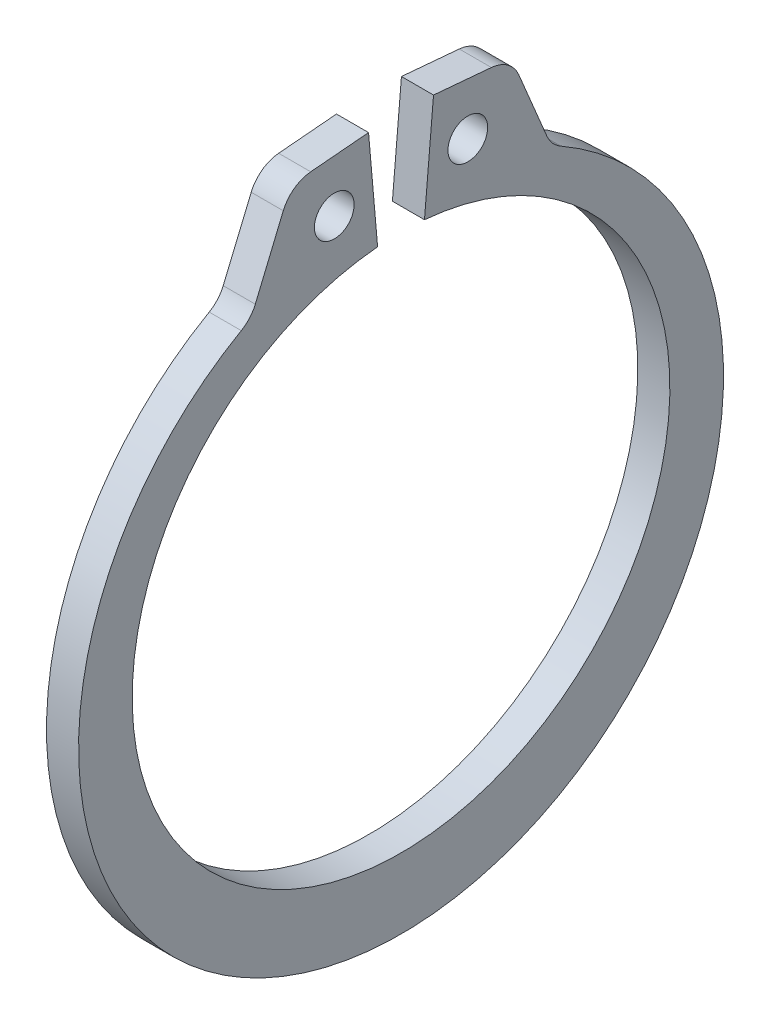
from build123d import *

# Parameters (mm, degrees)
SKETCH1_R      = 0.6604
EXTRUDE1_DEPTH = 0.5334
FILLET1_R      = 1.0922


with BuildPart() as part:
    # Sketch1 → Extrude1 (new, symmetric)
    with BuildSketch(Plane(origin=(0, 0, 0), x_dir=(0, 0, -1), z_dir=(1, 0, 0))):
        with BuildLine():
            Line((-0.779242065, 8.906777557), (-1.080312863, 12.348032522))
            Line((-1.080312863, 12.348032522), (-3.661254086, 12.122229423))
            Line((-3.661254086, 12.122229423), (-4.994033492, 8.935290702))
            ThreePointArc((-4.994033492, 8.935290702), (0, -11.2776), (4.994033492, 8.935290702))
            Line((4.994033492, 8.935290702), (3.661254086, 12.122229423))
            Line((3.661254086, 12.122229423), (1.080312863, 12.348032522))
            Line((1.080312863, 12.348032522), (0.779242065, 8.906777557))
            ThreePointArc((0.779242065, 8.906777557), (0, -8.9408), (-0.779242065, 8.906777557))
        make_face()
        with Locations((-2.220248076, 10.51450349)):
            Circle(SKETCH1_R, mode=Mode.SUBTRACT)
        with Locations((2.220248076, 10.51450349)):
            Circle(SKETCH1_R, mode=Mode.SUBTRACT)
    extrude(amount=EXTRUDE1_DEPTH, both=True)

    # Fillet1
    fillet1_edges = [part.edges().sort_by_distance(p)[0] for p in [
        (0, 12.122229423, -3.661254086),
        (0, 8.935290702, -4.994033492),
        (0, 8.935290702, 4.994033492),
        (0, 12.122229423, 3.661254086),
    ]]
    fillet(fillet1_edges, radius=FILLET1_R)


solid = part.part
